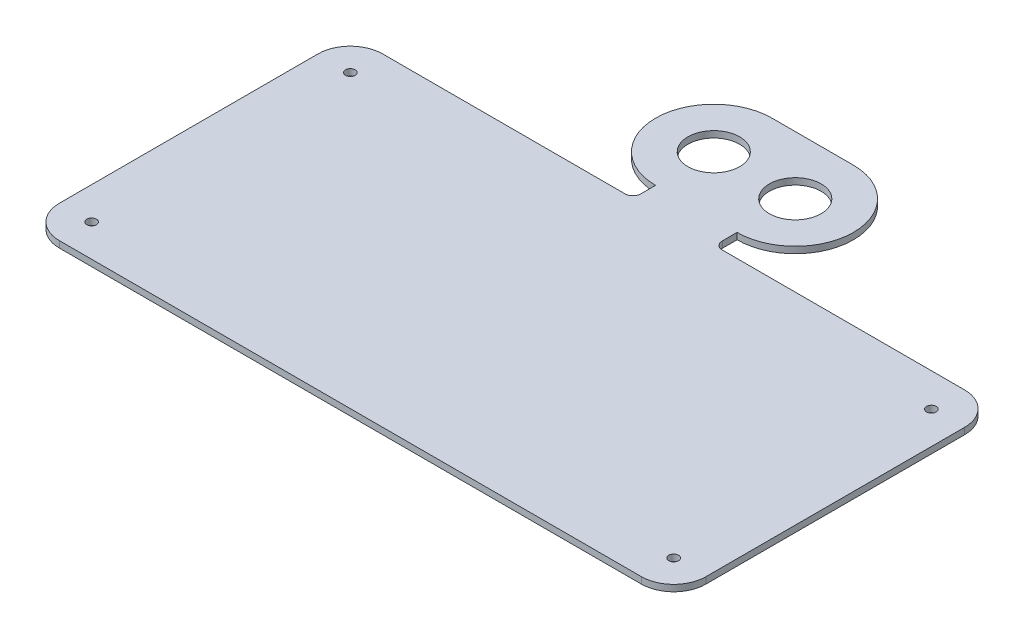
from build123d import *

# Parameters (mm, degrees)
SKETCH1_R           = 1.5
SKETCH1_R_2         = 8
BOSS_EXTRUDE6_DEPTH = 2


with BuildPart() as part:
    # Sketch1 → Boss-Extrude6 (new body)
    with BuildSketch(Plane(origin=(0, 0, 0), x_dir=(1, 0, 0), z_dir=(0, 1, 0))):
        with BuildLine():
            ThreePointArc((-42.892787305, 62.910010988), (-49.963855117, 59.981078799), (-52.892787305, 52.910010988))
            Line((-52.892787305, 52.910010988), (-52.892787305, 24.160010988))
            Line((-52.892787305, 24.160010988), (-52.892787305, 1.660010988))
            Line((-52.892787305, 1.660010988), (-52.892787305, -27.089989012))
            ThreePointArc((-52.892787305, -27.089989012), (-49.963855117, -34.161056824), (-42.892787305, -37.089989012))
            Line((-42.892787305, -37.089989012), (137.102440603, -37.089989012))
            ThreePointArc((137.102440603, -37.089989012), (144.173508414, -34.161056824), (147.102440603, -27.089989012))
            Line((147.102440603, -27.089989012), (147.102440603, 1.660010988))
            Line((147.102440603, 1.660010988), (147.102440603, 24.160010988))
            Line((147.102440603, 24.160010988), (147.102440603, 52.910010988))
            ThreePointArc((147.102440603, 52.910010988), (144.173508414, 59.981078799), (137.102440603, 62.910010988))
            Line((137.102440603, 62.910010988), (61.731596977, 62.910010988))
            ThreePointArc((61.731596977, 62.910010988), (60.27668109, 63.779465055), (59.705316327, 65.375169578))
            Line((59.705316327, 65.375169578), (59.705316327, 69.910696544))
            ThreePointArc((59.705316327, 69.910696544), (77.704972023, 87.799364481), (59.927976193, 105.909319341))
            Line((59.927976193, 105.909319341), (59.483635762, 105.909331429))
            Line((59.483635762, 105.909331429), (34.505806024, 105.910010948))
            Line((34.505806024, 105.910010948), (34.504826649, 105.910010974))
            ThreePointArc((34.504826649, 105.910010974), (16.504826662, 87.910010988), (34.504826649, 69.910011001))
            Line((34.504826649, 69.910011001), (34.504826649, 65.374484021))
            ThreePointArc((34.504826649, 65.374484021), (33.890722022, 63.738204886), (32.35168701, 62.910010988))
            Line((32.35168701, 62.910010988), (-42.892787305, 62.910010988))
        make_face()
        with Locations(Location((-42.892787305, -27.089989012, 0), (0, 0, 270))):
            Circle(SKETCH1_R, mode=Mode.SUBTRACT)
        with Locations(Location((137.102440603, -27.089989012, 0), (0, 0, 270))):
            Circle(SKETCH1_R, mode=Mode.SUBTRACT)
        with Locations(Location((-42.892787305, 52.910010988, 0), (0, 0, 270))):
            Circle(SKETCH1_R, mode=Mode.SUBTRACT)
        with Locations(Location((34.504826649, 87.910010988, 0), (0, 0, 270))):
            Circle(SKETCH1_R_2, mode=Mode.SUBTRACT)
        with Locations(Location((137.102440603, 52.612926661, 0), (0, 0, 270))):
            Circle(SKETCH1_R, mode=Mode.SUBTRACT)
        with Locations(Location((59.705316327, 87.910696544, 0), (0, 0, 270))):
            Circle(SKETCH1_R_2, mode=Mode.SUBTRACT)
    extrude(amount=BOSS_EXTRUDE6_DEPTH)


solid = part.part
